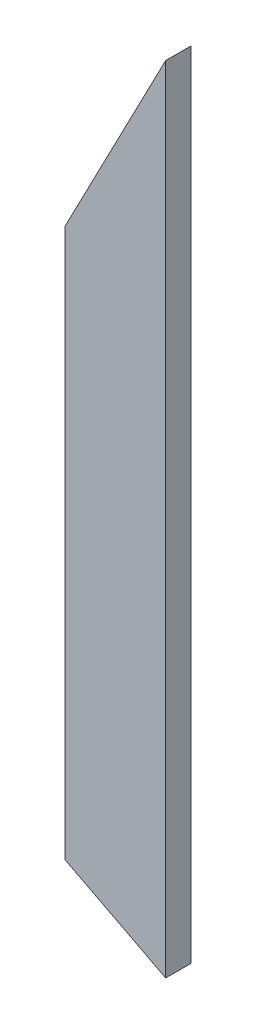
from build123d import *

# Parameters (mm, degrees)
BOSS_EXTRUDE1_DEPTH = 12.7


with BuildPart() as part:
    # Sketch1 → Boss-Extrude1 (new body)
    with BuildSketch(Plane.XY):
        Polygon((25.4, -200.787), (25.4, 200.787), (-25.4, 102.982417529), (-25.4, -174.494576745), align=None)
    extrude(amount=BOSS_EXTRUDE1_DEPTH)


solid = part.part
